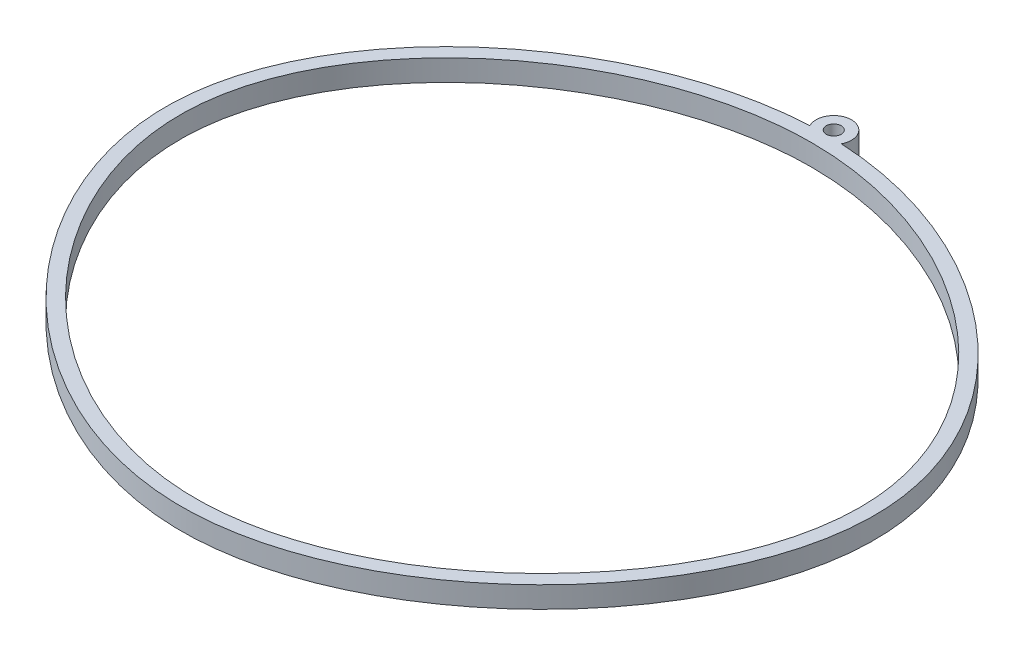
from build123d import *

# Parameters (mm, degrees)
SKETCH1_R           = 1.05
BOSS_EXTRUDE1_DEPTH = 3


with BuildPart() as part:
    # Sketch1 → Boss-Extrude1 (new body)
    # profile 1 of 2: a face of its own
    with BuildSketch(Plane(origin=(0, 0, 0), x_dir=(1, 0, 0), z_dir=(0, 1, 0))):
        with BuildLine():
            add(Edge.make_bspline(
                [(0, 41.087), (0.73948651, 41.087), (1.47897302, 41.068894144), (2.217810411, 41.033172899)],
                knots=[0, 0, 0, 0, 0.007296948, 0.007296948, 0.007296948, 0.007296948], degree=3))
            ThreePointArc((2.217810411, 41.033172899), (0, 44.687), (-2.217810411, 41.033172899))
            add(Edge.make_bspline(
                [(-2.217810411, 41.033172899), (-1.47897302, 41.068894144), (-0.73948651, 41.087), (0, 41.087)],
                knots=[0.992703052, 0.992703052, 0.992703052, 0.992703052, 1, 1, 1, 1], degree=3))
        make_face()
        with Locations(Location((0, 42.187, 0), (0, 0, 270))):
            Circle(SKETCH1_R, mode=Mode.SUBTRACT)
    # profile 2 of 2: a face of its own
    with BuildSketch(Plane(origin=(0, 0, 0), x_dir=(1, 0, 0), z_dir=(0, 1, 0))):
        with BuildLine():
            add(Edge.make_bspline(
                [(0, 41.087), (24.239239992, 41.087), (74.910188818, 0.42051916), (0, -75.955665108), (-74.910188818, 0.42051916), (-24.239239992, 41.087), (0, 41.087)],
                knots=[0, 0, 0, 0, 0.239182811, 0.5, 0.760817189, 1, 1, 1, 1], degree=3))
        make_face()
        with BuildLine():
            add(Edge.make_bspline(
                [(0, 39.087), (23.240826467, 39.087), (71.915264789, 0.439659971), (0, -72.965321113), (-71.915264789, 0.439659971), (-23.240826467, 39.087), (0, 39.087)],
                knots=[0, 0, 0, 0, 0.23873749, 0.5, 0.76126251, 1, 1, 1, 1], degree=3))
        make_face(mode=Mode.SUBTRACT)
    extrude(amount=BOSS_EXTRUDE1_DEPTH)


solid = part.part
